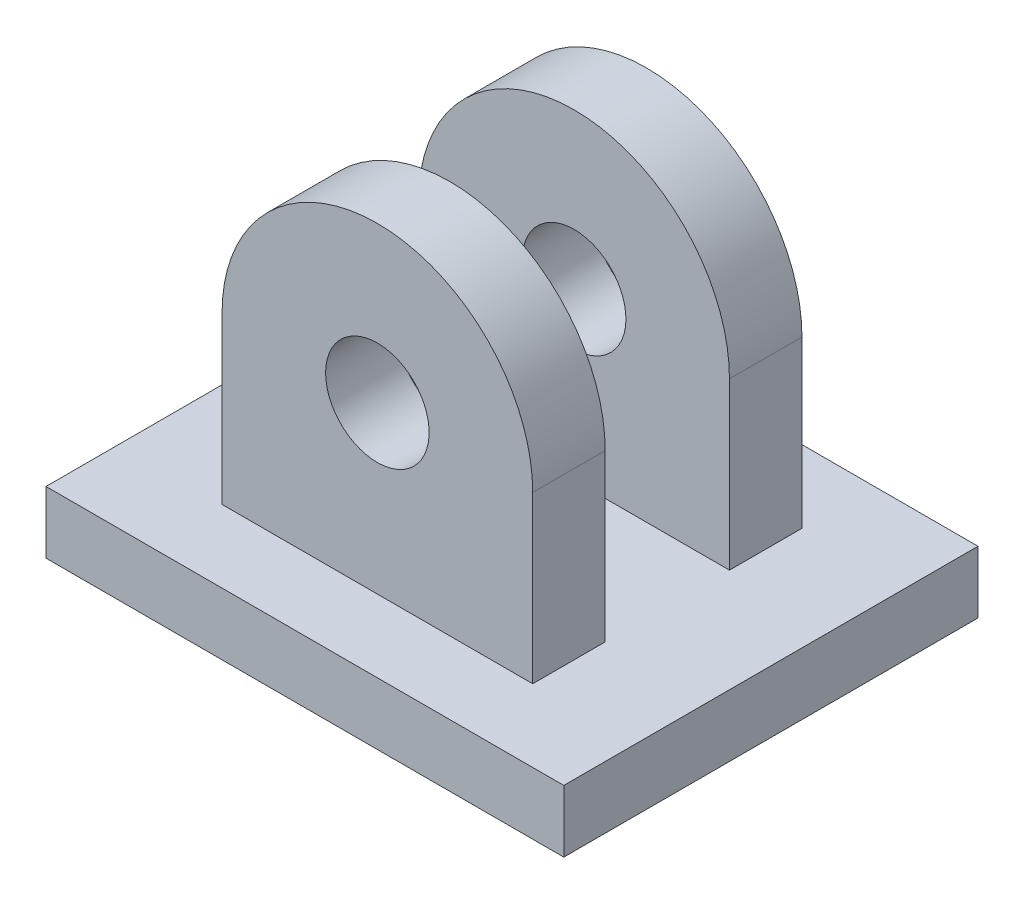
from build123d import *

# Parameters (mm, degrees)
SKETCH1_R          = 5
EXTRUDE1_DEPTH     = 40
SKETCH2_W          = 7
SKETCH2_H          = 34.499518557
SKETCH2_W_2        = 12
CUT_EXTRUDE1_DEPTH = 40


with BuildPart() as part:
    # Sketch1 → Extrude1 (new body)
    with BuildSketch(Plane.XY):
        with BuildLine():
            Line((15, -16), (25, -16))
            Line((25, -16), (25, -22))
            Line((25, -22), (-25, -22))
            Line((-25, -22), (-25, -16))
            Line((-25, -16), (-15, -16))
            Line((-15, -16), (-15, 0))
            ThreePointArc((-15, 0), (0, 15), (15, 0))
            Line((15, 0), (15, -16))
        make_face()
        Circle(SKETCH1_R, mode=Mode.SUBTRACT)
    extrude(amount=EXTRUDE1_DEPTH)

    # Sketch2 → Cut-Extrude1 (cut)
    with BuildSketch(Plane(origin=(15, 0, 0), x_dir=(0, 0, -1), z_dir=(1, 0, 0))):
        with Locations((-36.5, 1.249759279)):
            Rectangle(SKETCH2_W, SKETCH2_H)
        with Locations((-3.5, 1.249759279)):
            Rectangle(SKETCH2_W, SKETCH2_H)
        with Locations((-20, 1.249759279)):
            Rectangle(SKETCH2_W_2, SKETCH2_H)
    extrude(amount=-CUT_EXTRUDE1_DEPTH, mode=Mode.SUBTRACT)


solid = part.part
